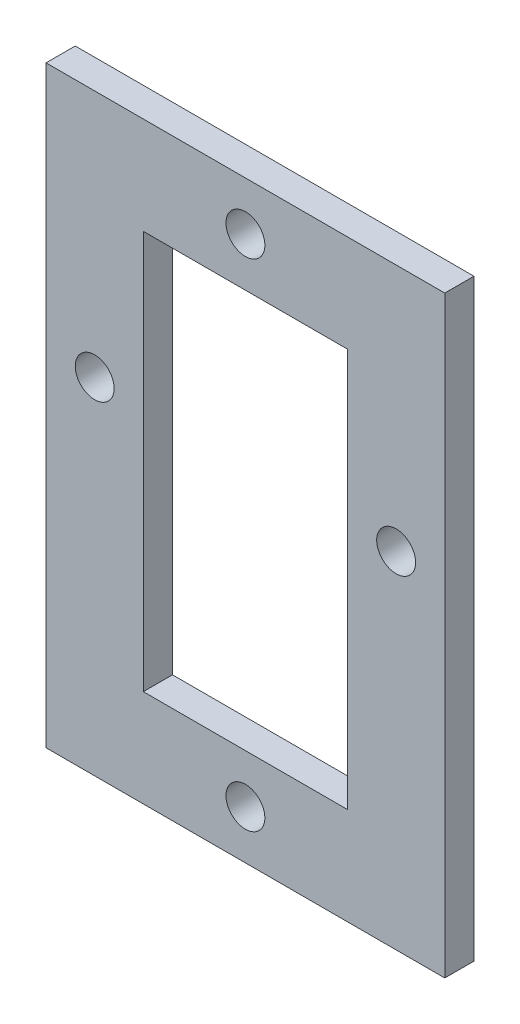
from build123d import *

# Parameters (mm, degrees)
SKETCH1_W           = 41
SKETCH1_H           = 61
BOSS_EXTRUDE1_DEPTH = 3
SKETCH2_W           = 21
SKETCH2_H           = 41
CUT_EXTRUDE1_DEPTH  = 3
SKETCH3_R           = 2
CUT_EXTRUDE2_DEPTH  = 3
SKETCH4_R           = 2
CUT_EXTRUDE3_DEPTH  = 10


with BuildPart() as part:
    # Sketch1 → Boss-Extrude1 (new body)
    with BuildSketch(Plane.XY):
        with Locations((20.5, -30.5)):
            Rectangle(SKETCH1_W, SKETCH1_H)
    extrude(amount=BOSS_EXTRUDE1_DEPTH)

    # Sketch2 → Cut-Extrude1 (cut)
    with BuildSketch(Plane.XY.offset(3)):
        with Locations((20.5, -30.5)):
            Rectangle(SKETCH2_W, SKETCH2_H)
    extrude(amount=-CUT_EXTRUDE1_DEPTH, mode=Mode.SUBTRACT)

    # Sketch3 → Cut-Extrude2 (cut)
    with BuildSketch(Plane.XY.offset(3)):
        with Locations((36, -25.5)):
            Circle(SKETCH3_R)
        with Locations((5, -25.5)):
            Circle(SKETCH3_R)
    extrude(amount=-CUT_EXTRUDE2_DEPTH, mode=Mode.SUBTRACT)

    # Sketch4 → Cut-Extrude3 (cut)
    with BuildSketch(Plane.XY.offset(3)):
        with Locations((20.5, -5)):
            Circle(SKETCH4_R)
        with Locations((20.5, -56)):
            Circle(SKETCH4_R)
    extrude(amount=-CUT_EXTRUDE3_DEPTH, mode=Mode.SUBTRACT)


solid = part.part
